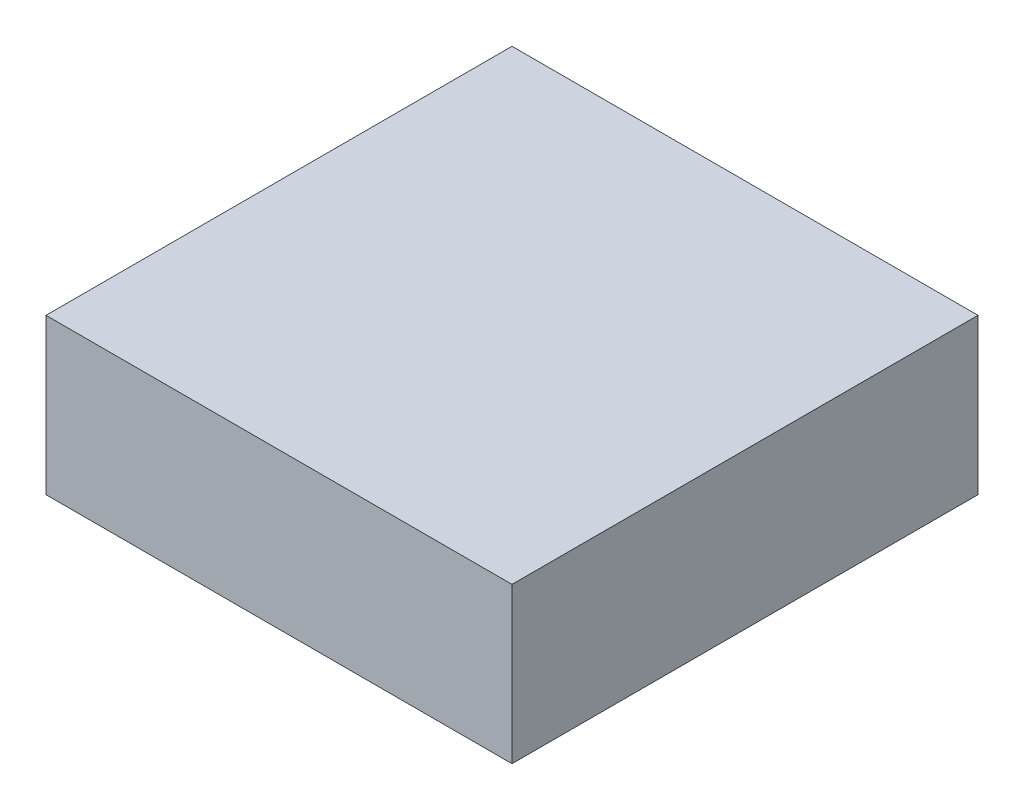
from build123d import *

# Parameters (mm, degrees)
SKETCH_1_W      = 30
SKETCH_1_H      = 30
EXTRUDE_1_DEPTH = 10


with BuildPart() as part:
    # 草图1 → 凸台-拉伸1 (new body)
    with BuildSketch(Plane(origin=(0, 0, 0), x_dir=(1, 0, 0), z_dir=(0, 1, 0))):
        with Locations((5, 1.588235294)):
            Rectangle(SKETCH_1_W, SKETCH_1_H)
    extrude(amount=EXTRUDE_1_DEPTH)


solid = part.part
